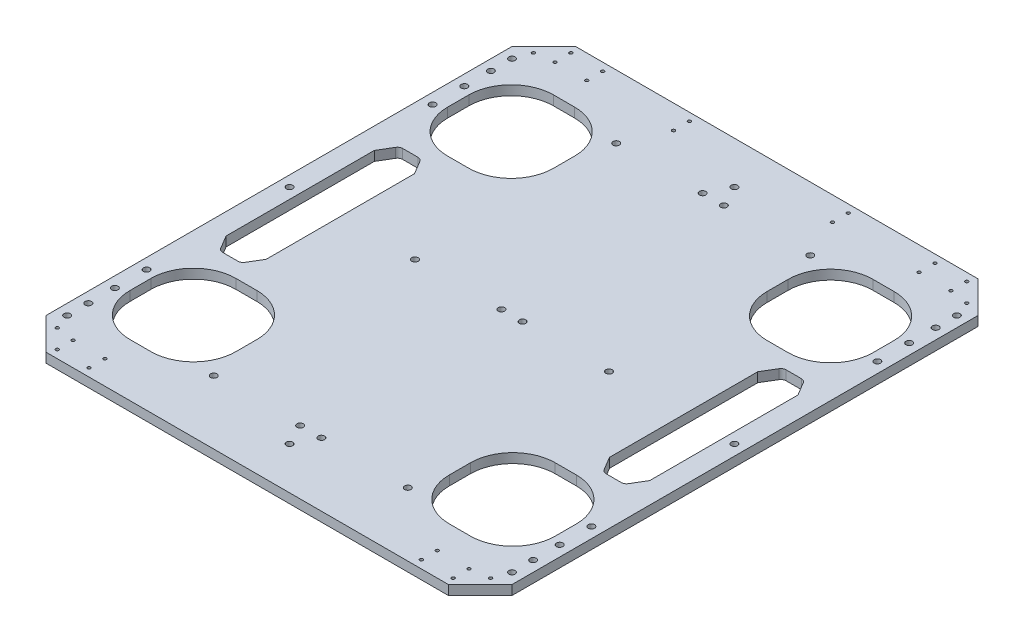
from build123d import *

# Parameters (mm, degrees)
CROQUIS1_W              = 440
CROQUIS1_H              = 440
SALIENTE_EXTRUIR1_DEPTH = 9
CROQUIS2_R              = 2
CORTAR_EXTRUIR1_DEPTH   = 312.257128432
CORTAR_EXTRUIR2_DEPTH   = 312.257128432
CORTAR_EXTRUIR3_DEPTH   = 312.257128432
REDONDEO1_R             = 5
CROQUIS5_R              = 2
CORTAR_EXTRUIR4_DEPTH   = 312.257128432
SALIENTE_EXTRUIR3_DEPTH = 9
CROQUIS8_R              = 1.5
CORTAR_EXTRUIR7_DEPTH   = 334.138109498
CROQUIS9_R              = 3
CORTAR_EXTRUIR8_DEPTH   = 334.138109498


with BuildPart() as part:
    # Croquis1 → Saliente-Extruir1 (new body)
    with BuildSketch(Plane(origin=(0, 0, 0), x_dir=(1, 0, 0), z_dir=(0, 1, 0))):
        Rectangle(CROQUIS1_W, CROQUIS1_H)
    extrude(amount=SALIENTE_EXTRUIR1_DEPTH)

    # Croquis2 → Cortar-Extruir1 (cut, through all)
    with BuildSketch(Plane(origin=(0, 9, 0), x_dir=(1, 0, 0), z_dir=(0, 1, 0))):
        with Locations(Location((-210, 210, 0), (0, 0, 270))):
            Circle(CROQUIS2_R)
        with Locations(Location((0, 210, 0), (0, 0, 270))):
            Circle(CROQUIS2_R)
        with Locations(Location((-210, 190, 0), (0, 0, 270))):
            Circle(CROQUIS2_R)
        with Locations(Location((-10, 190, 0), (0, 0, 270))):
            Circle(CROQUIS2_R)
        with Locations(Location((-210, 0, 0), (0, 0, 270))):
            Circle(CROQUIS2_R)
        with Locations(Location((-10, 0, 0), (0, 0, 270))):
            Circle(CROQUIS2_R)
        with Locations(Location((0, -210, 0), (0, 0, 90))):
            Circle(CROQUIS2_R)
        with Locations(Location((-10, -190, 0), (0, 0, 90))):
            Circle(CROQUIS2_R)
        with Locations(Location((-210, -190, 0), (0, 0, 90))):
            Circle(CROQUIS2_R)
        with Locations(Location((-210, -210, 0), (0, 0, 90))):
            Circle(CROQUIS2_R)
        with Locations(Location((10, -190, 0), (0, 0, 270))):
            Circle(CROQUIS2_R)
        with Locations(Location((210, -210, 0), (0, 0, 270))):
            Circle(CROQUIS2_R)
        with Locations(Location((210, -190, 0), (0, 0, 270))):
            Circle(CROQUIS2_R)
        with Locations(Location((210, 0, 0), (0, 0, 90))):
            Circle(CROQUIS2_R)
        with Locations(Location((10, 0, 0), (0, 0, 90))):
            Circle(CROQUIS2_R)
        with Locations(Location((10, 190, 0), (0, 0, 90))):
            Circle(CROQUIS2_R)
        with Locations(Location((210, 190, 0), (0, 0, 90))):
            Circle(CROQUIS2_R)
        with Locations(Location((210, 210, 0), (0, 0, 90))):
            Circle(CROQUIS2_R)
        with Locations(Location((-91.6, 190, 0), (0, 0, 270))):
            Circle(CROQUIS2_R)
        with Locations(Location((91.6, 190, 0), (0, 0, 90))):
            Circle(CROQUIS2_R)
        with Locations(Location((-91.6, 0, 0), (0, 0, 270))):
            Circle(CROQUIS2_R)
        with Locations(Location((91.6, -190, 0), (0, 0, 270))):
            Circle(CROQUIS2_R)
        with Locations(Location((-91.6, -190, 0), (0, 0, 90))):
            Circle(CROQUIS2_R)
        with Locations(Location((91.6, 0, 0), (0, 0, 90))):
            Circle(CROQUIS2_R)
    extrude(amount=-CORTAR_EXTRUIR1_DEPTH, mode=Mode.SUBTRACT)

    # Croquis3 → Cortar-Extruir2 (cut, through all)
    with BuildSketch(Plane(origin=(0, 9, 0), x_dir=(1, 0, 0), z_dir=(0, 1, 0))):
        Polygon((-200, -70), (-200, 70), (-191, 85), (-171, 85), (-162, 70), (-162, -70), (-171, -85), (-191, -85), align=None)
        Polygon((171, 85), (162, 70), (162, -70), (171, -85), (191, -85), (200, -70), (200, 70), (191, 85), align=None)
    extrude(amount=-CORTAR_EXTRUIR2_DEPTH, mode=Mode.SUBTRACT)

    # Croquis4 → Cortar-Extruir3 (cut, through all)
    with BuildSketch(Plane(origin=(0, 9, 0), x_dir=(1, 0, 0), z_dir=(0, 1, 0))):
        with BuildLine():
            Line((160.8, 100), (140.8, 100))
            ThreePointArc((140.8, 100), (112.515728753, 111.715728753), (100.8, 140))
            Line((100.8, 140), (100.8, 160))
            ThreePointArc((100.8, 160), (112.515728753, 188.284271247), (140.8, 200))
            Line((140.8, 200), (160.8, 200))
            ThreePointArc((160.8, 200), (189.084271247, 188.284271247), (200.8, 160))
            Line((200.8, 160), (200.8, 140))
            ThreePointArc((200.8, 140), (189.084271247, 111.715728753), (160.8, 100))
        make_face()
        with BuildLine():
            Line((-160.8, 200), (-140.8, 200))
            ThreePointArc((-140.8, 200), (-112.515728753, 188.284271247), (-100.8, 160))
            Line((-100.8, 160), (-100.8, 140))
            ThreePointArc((-100.8, 140), (-112.515728753, 111.715728753), (-140.8, 100))
            Line((-140.8, 100), (-160.8, 100))
            ThreePointArc((-160.8, 100), (-189.084271247, 111.715728753), (-200.8, 140))
            Line((-200.8, 140), (-200.8, 160))
            ThreePointArc((-200.8, 160), (-189.084271247, 188.284271247), (-160.8, 200))
        make_face()
        with BuildLine():
            Line((-160.8, -100), (-140.8, -100))
            ThreePointArc((-140.8, -100), (-112.515728753, -111.715728753), (-100.8, -140))
            Line((-100.8, -140), (-100.8, -160))
            ThreePointArc((-100.8, -160), (-112.515728753, -188.284271247), (-140.8, -200))
            Line((-140.8, -200), (-160.8, -200))
            ThreePointArc((-160.8, -200), (-189.084271247, -188.284271247), (-200.8, -160))
            Line((-200.8, -160), (-200.8, -140))
            ThreePointArc((-200.8, -140), (-189.084271247, -111.715728753), (-160.8, -100))
        make_face()
        with BuildLine():
            Line((200.8, -160), (200.8, -140))
            ThreePointArc((200.8, -140), (189.084271247, -111.715728753), (160.8, -100))
            Line((160.8, -100), (140.8, -100))
            ThreePointArc((140.8, -100), (112.515728753, -111.715728753), (100.8, -140))
            Line((100.8, -140), (100.8, -160))
            ThreePointArc((100.8, -160), (112.515728753, -188.284271247), (140.8, -200))
            Line((140.8, -200), (160.8, -200))
            ThreePointArc((160.8, -200), (189.084271247, -188.284271247), (200.8, -160))
        make_face()
    extrude(amount=-CORTAR_EXTRUIR3_DEPTH, mode=Mode.SUBTRACT)

    # Redondeo1
    redondeo1_edges = [part.edges().sort_by_distance(p)[0] for p in [
        (-171, 4.5, 85),
        (-191, 4.5, 85),
        (-191, 4.5, -85),
        (-171, 4.5, -85),
        (171, 4.5, -85),
        (191, 4.5, -85),
        (191, 4.5, 85),
        (171, 4.5, 85),
    ]]
    fillet(redondeo1_edges, radius=REDONDEO1_R)

    # Croquis5 → Cortar-Extruir4 (cut, through all)
    with BuildSketch(Plane(origin=(0, 9, 0), x_dir=(1, 0, 0), z_dir=(0, 1, 0))):
        with Locations(Location((-210, 165, 0), (0, 0, 270))):
            Circle(CROQUIS5_R)
        with Locations(Location((-210, 135, 0), (0, 0, 270))):
            Circle(CROQUIS5_R)
        with Locations(Location((-210, -135, 0), (0, 0, 90))):
            Circle(CROQUIS5_R)
        with Locations(Location((-210, -165, 0), (0, 0, 90))):
            Circle(CROQUIS5_R)
        with Locations(Location((210, -165, 0), (0, 0, 270))):
            Circle(CROQUIS5_R)
        with Locations(Location((210, -135, 0), (0, 0, 270))):
            Circle(CROQUIS5_R)
        with Locations(Location((210, 135, 0), (0, 0, 90))):
            Circle(CROQUIS5_R)
        with Locations(Location((210, 165, 0), (0, 0, 90))):
            Circle(CROQUIS5_R)
    extrude(amount=-CORTAR_EXTRUIR4_DEPTH, mode=Mode.SUBTRACT)

    # Croquis7 → Saliente-Extruir3 (add)
    with BuildSketch(Plane(origin=(0, 9, 0), x_dir=(1, 0, 0), z_dir=(0, 1, 0))):
        Polygon((220, 220), (-220, 220), (-190, 250), (190, 250), align=None)
        Polygon((220, -220), (190, -250), (-190, -250), (-220, -220), align=None)
    extrude(amount=-SALIENTE_EXTRUIR3_DEPTH)

    # Croquis8 → Cortar-Extruir7 (cut, through all)
    with BuildSketch(Plane(origin=(0, 9, 0), x_dir=(1, 0, 0), z_dir=(0, 1, 0))):
        with Locations(Location((-75, 242.5, 0), (0, 0, 270))):
            Circle(CROQUIS8_R)
        with Locations(Location((-75, 227.5, 0), (0, 0, 90))):
            Circle(CROQUIS8_R)
        with Locations(Location((75, 227.5, 0), (0, 0, 270))):
            Circle(CROQUIS8_R)
        with Locations(Location((75, 242.5, 0), (0, 0, 90))):
            Circle(CROQUIS8_R)
        with Locations(Location((-186.893398282, 242.5, 0), (0, 0, 270))):
            Circle(CROQUIS8_R)
        with Locations(Location((-204.571067812, 224.82233047, 0), (0, 0, 270))):
            Circle(CROQUIS8_R)
        with Locations(Location((-156.893398282, 242.5, 0), (0, 0, 270))):
            Circle(CROQUIS8_R)
        with Locations(Location((-156.893398282, 227.5, 0), (0, 0, 90))):
            Circle(CROQUIS8_R)
        with Locations(Location((-186.893398282, 227.5, 0), (0, 0, 90))):
            Circle(CROQUIS8_R)
        with Locations(Location((186.893398282, 227.5, 0), (0, 0, 270))):
            Circle(CROQUIS8_R)
        with Locations(Location((156.893398282, 227.5, 0), (0, 0, 270))):
            Circle(CROQUIS8_R)
        with Locations(Location((156.893398282, 242.5, 0), (0, 0, 90))):
            Circle(CROQUIS8_R)
        with Locations(Location((204.571067812, 224.82233047, 0), (0, 0, 90))):
            Circle(CROQUIS8_R)
        with Locations(Location((186.893398282, 242.5, 0), (0, 0, 90))):
            Circle(CROQUIS8_R)
        with Locations(Location((186.893398282, -242.5, 0), (0, 0, 270))):
            Circle(CROQUIS8_R)
        with Locations(Location((204.571067812, -224.82233047, 0), (0, 0, 270))):
            Circle(CROQUIS8_R)
        with Locations(Location((156.893398282, -242.5, 0), (0, 0, 270))):
            Circle(CROQUIS8_R)
        with Locations(Location((156.893398282, -227.5, 0), (0, 0, 90))):
            Circle(CROQUIS8_R)
        with Locations(Location((186.893398282, -227.5, 0), (0, 0, 90))):
            Circle(CROQUIS8_R)
        with Locations(Location((-186.893398282, -227.5, 0), (0, 0, 270))):
            Circle(CROQUIS8_R)
        with Locations(Location((-156.893398282, -227.5, 0), (0, 0, 270))):
            Circle(CROQUIS8_R)
        with Locations(Location((-156.893398282, -242.5, 0), (0, 0, 90))):
            Circle(CROQUIS8_R)
        with Locations(Location((-204.571067812, -224.82233047, 0), (0, 0, 90))):
            Circle(CROQUIS8_R)
        with Locations(Location((-186.893398282, -242.5, 0), (0, 0, 90))):
            Circle(CROQUIS8_R)
    extrude(amount=-CORTAR_EXTRUIR7_DEPTH, mode=Mode.SUBTRACT)

    # Croquis9 → Cortar-Extruir8 (cut, through all)
    with BuildSketch(Plane(origin=(0, 9, 0), x_dir=(1, 0, 0), z_dir=(0, 1, 0))):
        with Locations(Location((-210, 210, 0), (0, 0, 270))):
            Circle(CROQUIS9_R)
        with Locations(Location((-210, 190, 0), (0, 0, 270))):
            Circle(CROQUIS9_R)
        with Locations(Location((-210, 165, 0), (0, 0, 270))):
            Circle(CROQUIS9_R)
        with Locations(Location((-210, 135, 0), (0, 0, 270))):
            Circle(CROQUIS9_R)
        with Locations(Location((-210, 0, 0), (0, 0, 270))):
            Circle(CROQUIS9_R)
        with Locations(Location((-91.6, 0, 0), (0, 0, 270))):
            Circle(CROQUIS9_R)
        with Locations(Location((-10, 0, 0), (0, 0, 270))):
            Circle(CROQUIS9_R)
        with Locations(Location((0, 210, 0), (0, 0, 270))):
            Circle(CROQUIS9_R)
        with Locations(Location((-10, 190, 0), (0, 0, 270))):
            Circle(CROQUIS9_R)
        with Locations(Location((-91.6, 190, 0), (0, 0, 270))):
            Circle(CROQUIS9_R)
        with Locations(Location((210, 0, 0), (0, 0, 90))):
            Circle(CROQUIS9_R)
        with Locations(Location((91.6, 0, 0), (0, 0, 90))):
            Circle(CROQUIS9_R)
        with Locations(Location((10, 0, 0), (0, 0, 90))):
            Circle(CROQUIS9_R)
        with Locations(Location((91.6, 190, 0), (0, 0, 90))):
            Circle(CROQUIS9_R)
        with Locations(Location((10, 190, 0), (0, 0, 90))):
            Circle(CROQUIS9_R)
        with Locations(Location((210, 135, 0), (0, 0, 90))):
            Circle(CROQUIS9_R)
        with Locations(Location((210, 165, 0), (0, 0, 90))):
            Circle(CROQUIS9_R)
        with Locations(Location((210, 190, 0), (0, 0, 90))):
            Circle(CROQUIS9_R)
        with Locations(Location((210, 210, 0), (0, 0, 90))):
            Circle(CROQUIS9_R)
        with Locations(Location((210, -210, 0), (0, 0, 270))):
            Circle(CROQUIS9_R)
        with Locations(Location((210, -190, 0), (0, 0, 270))):
            Circle(CROQUIS9_R)
        with Locations(Location((210, -165, 0), (0, 0, 270))):
            Circle(CROQUIS9_R)
        with Locations(Location((210, -135, 0), (0, 0, 270))):
            Circle(CROQUIS9_R)
        with Locations(Location((10, -190, 0), (0, 0, 270))):
            Circle(CROQUIS9_R)
        with Locations(Location((91.6, -190, 0), (0, 0, 270))):
            Circle(CROQUIS9_R)
        with Locations(Location((-91.6, -190, 0), (0, 0, 90))):
            Circle(CROQUIS9_R)
        with Locations(Location((-10, -190, 0), (0, 0, 90))):
            Circle(CROQUIS9_R)
        with Locations(Location((0, -210, 0), (0, 0, 90))):
            Circle(CROQUIS9_R)
        with Locations(Location((-210, -135, 0), (0, 0, 90))):
            Circle(CROQUIS9_R)
        with Locations(Location((-210, -165, 0), (0, 0, 90))):
            Circle(CROQUIS9_R)
        with Locations(Location((-210, -190, 0), (0, 0, 90))):
            Circle(CROQUIS9_R)
        with Locations(Location((-210, -210, 0), (0, 0, 90))):
            Circle(CROQUIS9_R)
    extrude(amount=-CORTAR_EXTRUIR8_DEPTH, mode=Mode.SUBTRACT)


solid = part.part
